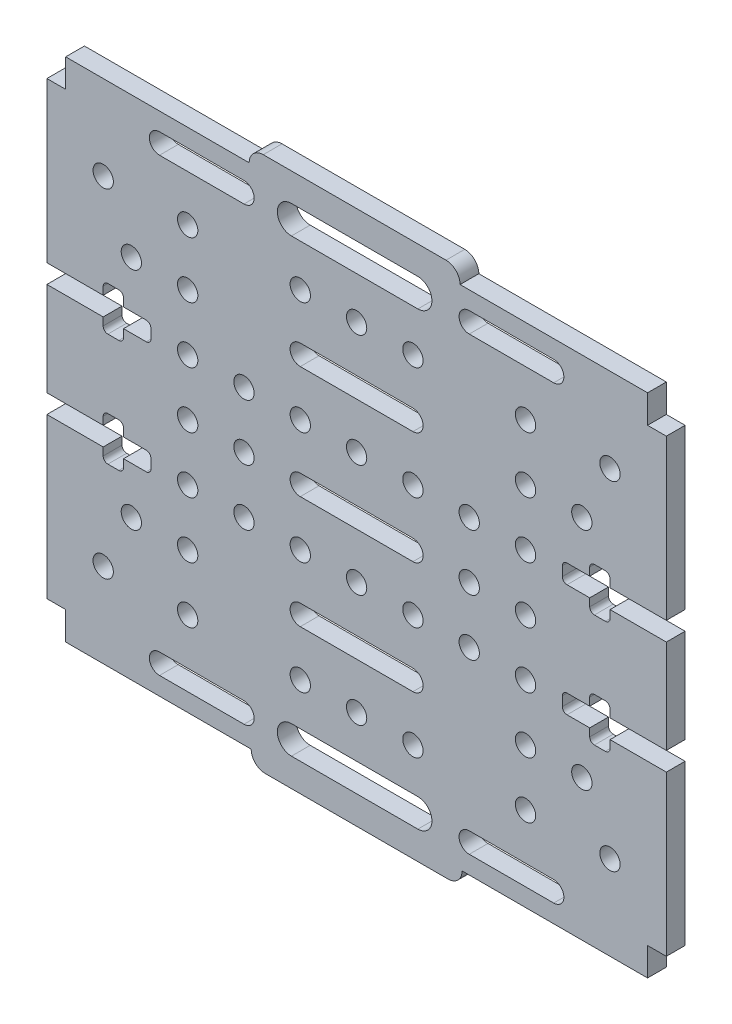
from build123d import *

# Parameters (mm, degrees)
MODEL_R                 = 1.625
SALIENTE_EXTRUIR1_DEPTH = 3


with BuildPart() as part:
    # Model → Saliente-Extruir1 (new body)
    with BuildSketch(Plane.XY):
        with BuildLine():
            Line((-1386.726934946, 396.908179756), (-1386.726934946, 392.408179756))
            Line((-1386.726934946, 392.408179756), (-1383.726934946, 392.408179756))
            Line((-1383.726934946, 392.408179756), (-1383.726934946, 366.908179756))
            Line((-1383.726934946, 366.908179756), (-1392.721934946, 366.908179756))
            Line((-1392.721934946, 366.908179756), (-1392.721934946, 368.158179756))
            ThreePointArc((-1392.721934946, 368.158179756), (-1392.94160486, 368.688509842), (-1393.471934946, 368.908179756))
            Line((-1393.471934946, 368.908179756), (-1395.221934946, 368.908179756))
            ThreePointArc((-1395.221934946, 368.908179756), (-1395.752265032, 368.688509842), (-1395.971934946, 368.158179756))
            Line((-1395.971934946, 368.158179756), (-1395.971934946, 366.908179756))
            Line((-1395.971934946, 366.908179756), (-1399.596934946, 366.908179756))
            ThreePointArc((-1399.596934946, 366.908179756), (-1400.127265032, 366.688509842), (-1400.346934946, 366.158179756))
            Line((-1400.346934946, 366.158179756), (-1400.346934946, 364.658179756))
            ThreePointArc((-1400.346934946, 364.658179756), (-1400.127265032, 364.127849671), (-1399.596934946, 363.908179756))
            Line((-1399.596934946, 363.908179756), (-1395.971934946, 363.908179756))
            Line((-1395.971934946, 363.908179756), (-1395.971934946, 362.658179756))
            ThreePointArc((-1395.971934946, 362.658179756), (-1395.752265032, 362.127849671), (-1395.221934946, 361.908179756))
            Line((-1395.221934946, 361.908179756), (-1393.471934946, 361.908179756))
            ThreePointArc((-1393.471934946, 361.908179756), (-1392.94160486, 362.127849671), (-1392.721934946, 362.658179756))
            Line((-1392.721934946, 362.658179756), (-1392.721934946, 363.908179756))
            Line((-1392.721934946, 363.908179756), (-1383.726934946, 363.908179756))
            Line((-1383.726934946, 363.908179756), (-1383.726934946, 348.908179756))
            Line((-1383.726934946, 348.908179756), (-1392.721934946, 348.908179756))
            Line((-1392.721934946, 348.908179756), (-1392.721934946, 350.158179756))
            ThreePointArc((-1392.721934946, 350.158179756), (-1392.94160486, 350.688509842), (-1393.471934946, 350.908179756))
            Line((-1393.471934946, 350.908179756), (-1395.221934946, 350.908179756))
            ThreePointArc((-1395.221934946, 350.908179756), (-1395.752265032, 350.688509842), (-1395.971934946, 350.158179756))
            Line((-1395.971934946, 350.158179756), (-1395.971934946, 348.908179756))
            Line((-1395.971934946, 348.908179756), (-1399.596934946, 348.908179756))
            ThreePointArc((-1399.596934946, 348.908179756), (-1400.127265032, 348.688509842), (-1400.346934946, 348.158179756))
            Line((-1400.346934946, 348.158179756), (-1400.346934946, 346.658179756))
            ThreePointArc((-1400.346934946, 346.658179756), (-1400.127265032, 346.127849671), (-1399.596934946, 345.908179756))
            Line((-1399.596934946, 345.908179756), (-1395.971934946, 345.908179756))
            Line((-1395.971934946, 345.908179756), (-1395.971934946, 344.658179756))
            ThreePointArc((-1395.971934946, 344.658179756), (-1395.752265032, 344.127849671), (-1395.221934946, 343.908179757))
            Line((-1395.221934946, 343.908179757), (-1393.471934946, 343.908179757))
            ThreePointArc((-1393.471934946, 343.908179757), (-1392.94160486, 344.127849671), (-1392.721934946, 344.658179756))
            Line((-1392.721934946, 344.658179756), (-1392.721934946, 345.908179756))
            Line((-1392.721934946, 345.908179756), (-1383.726934946, 345.908179756))
            Line((-1383.726934946, 345.908179756), (-1383.726934946, 320.408179756))
            Line((-1383.726934946, 320.408179756), (-1386.726934946, 320.408179756))
            Line((-1386.726934946, 320.408179756), (-1386.726934946, 315.908179756))
            Line((-1386.726934946, 315.908179756), (-1416.374030817, 315.908179756))
            ThreePointArc((-1416.374030817, 315.908179756), (-1417.033040559, 314.317189499), (-1418.624030817, 313.658179756))
            Line((-1418.624030817, 313.658179756), (-1447.829839075, 313.658179756))
            ThreePointArc((-1447.829839075, 313.658179756), (-1449.420829333, 314.317189499), (-1450.079839075, 315.908179756))
            Line((-1450.079839075, 315.908179756), (-1479.726934946, 315.908179756))
            Line((-1479.726934946, 315.908179756), (-1479.726934946, 320.408179756))
            Line((-1479.726934946, 320.408179756), (-1482.726934946, 320.408179756))
            Line((-1482.726934946, 320.408179756), (-1482.726934946, 345.908179756))
            Line((-1482.726934946, 345.908179756), (-1473.731934946, 345.908179756))
            Line((-1473.731934946, 345.908179756), (-1473.731934946, 344.658179756))
            ThreePointArc((-1473.731934946, 344.658179756), (-1473.512265032, 344.127849671), (-1472.981934946, 343.908179757))
            Line((-1472.981934946, 343.908179757), (-1471.231934946, 343.908179757))
            ThreePointArc((-1471.231934946, 343.908179757), (-1470.70160486, 344.127849671), (-1470.481934946, 344.658179756))
            Line((-1470.481934946, 344.658179756), (-1470.481934946, 345.908179756))
            Line((-1470.481934946, 345.908179756), (-1466.856934946, 345.908179756))
            ThreePointArc((-1466.856934946, 345.908179756), (-1466.32660486, 346.127849671), (-1466.106934946, 346.658179756))
            Line((-1466.106934946, 346.658179756), (-1466.106934946, 348.158179756))
            ThreePointArc((-1466.106934946, 348.158179756), (-1466.32660486, 348.688509842), (-1466.856934946, 348.908179756))
            Line((-1466.856934946, 348.908179756), (-1470.481934946, 348.908179756))
            Line((-1470.481934946, 348.908179756), (-1470.481934946, 350.158179756))
            ThreePointArc((-1470.481934946, 350.158179756), (-1470.70160486, 350.688509842), (-1471.231934946, 350.908179756))
            Line((-1471.231934946, 350.908179756), (-1472.981934946, 350.908179756))
            ThreePointArc((-1472.981934946, 350.908179756), (-1473.512265032, 350.688509842), (-1473.731934946, 350.158179756))
            Line((-1473.731934946, 350.158179756), (-1473.731934946, 348.908179756))
            Line((-1473.731934946, 348.908179756), (-1482.726934946, 348.908179756))
            Line((-1482.726934946, 348.908179756), (-1482.726934946, 363.908179756))
            Line((-1482.726934946, 363.908179756), (-1473.731934946, 363.908179756))
            Line((-1473.731934946, 363.908179756), (-1473.731934946, 362.658179756))
            ThreePointArc((-1473.731934946, 362.658179756), (-1473.512265032, 362.127849671), (-1472.981934946, 361.908179756))
            Line((-1472.981934946, 361.908179756), (-1471.231934946, 361.908179756))
            ThreePointArc((-1471.231934946, 361.908179756), (-1470.70160486, 362.127849671), (-1470.481934946, 362.658179756))
            Line((-1470.481934946, 362.658179756), (-1470.481934946, 363.908179756))
            Line((-1470.481934946, 363.908179756), (-1466.856934946, 363.908179756))
            ThreePointArc((-1466.856934946, 363.908179756), (-1466.32660486, 364.127849671), (-1466.106934946, 364.658179756))
            Line((-1466.106934946, 364.658179756), (-1466.106934946, 366.158179756))
            ThreePointArc((-1466.106934946, 366.158179756), (-1466.32660486, 366.688509842), (-1466.856934946, 366.908179756))
            Line((-1466.856934946, 366.908179756), (-1470.481934946, 366.908179756))
            Line((-1470.481934946, 366.908179756), (-1470.481934946, 368.158179756))
            ThreePointArc((-1470.481934946, 368.158179756), (-1470.70160486, 368.688509842), (-1471.231934946, 368.908179756))
            Line((-1471.231934946, 368.908179756), (-1472.981934946, 368.908179756))
            ThreePointArc((-1472.981934946, 368.908179756), (-1473.512265032, 368.688509842), (-1473.731934946, 368.158179756))
            Line((-1473.731934946, 368.158179756), (-1473.731934946, 366.908179756))
            Line((-1473.731934946, 366.908179756), (-1482.726934946, 366.908179756))
            Line((-1482.726934946, 366.908179756), (-1482.726934946, 392.408179756))
            Line((-1482.726934946, 392.408179756), (-1479.726934946, 392.408179756))
            Line((-1479.726934946, 392.408179756), (-1479.726934946, 396.908179756))
            Line((-1479.726934946, 396.908179756), (-1450.397354792, 396.908179756))
            ThreePointArc((-1450.397354792, 396.908179756), (-1449.73834505, 398.499170014), (-1448.147354793, 399.158179756))
            Line((-1448.147354793, 399.158179756), (-1418.941546534, 399.158179756))
            ThreePointArc((-1418.941546534, 399.158179756), (-1417.350556277, 398.499170014), (-1416.691546534, 396.908179756))
            Line((-1416.691546534, 396.908179756), (-1386.726934946, 396.908179756))
        make_face()
        with Locations((-1433.229894918, 365.413124117)):
            Circle(MODEL_R, mode=Mode.SUBTRACT)
        with Locations((-1433.229894918, 347.413124117)):
            Circle(MODEL_R, mode=Mode.SUBTRACT)
        with Locations((-1433.229894918, 329.413124117)):
            Circle(MODEL_R, mode=Mode.SUBTRACT)
        with Locations((-1433.229894918, 383.413124117)):
            Circle(MODEL_R, mode=Mode.SUBTRACT)
        with Locations((-1460.229894918, 374.413124117)):
            Circle(MODEL_R, mode=Mode.SUBTRACT)
        with Locations((-1460.229894918, 365.413124117)):
            Circle(MODEL_R, mode=Mode.SUBTRACT)
        with Locations((-1460.229894918, 356.413124117)):
            Circle(MODEL_R, mode=Mode.SUBTRACT)
        with Locations((-1460.229894918, 347.413124117)):
            Circle(MODEL_R, mode=Mode.SUBTRACT)
        with Locations((-1460.229894918, 338.413124117)):
            Circle(MODEL_R, mode=Mode.SUBTRACT)
        with Locations((-1460.229894918, 329.413124117)):
            Circle(MODEL_R, mode=Mode.SUBTRACT)
        with Locations((-1460.229894918, 383.413124117)):
            Circle(MODEL_R, mode=Mode.SUBTRACT)
        with Locations((-1406.229894918, 374.413124117)):
            Circle(MODEL_R, mode=Mode.SUBTRACT)
        with Locations((-1406.229894918, 365.413124117)):
            Circle(MODEL_R, mode=Mode.SUBTRACT)
        with Locations((-1406.229894918, 356.413124117)):
            Circle(MODEL_R, mode=Mode.SUBTRACT)
        with Locations((-1406.229894918, 347.413124117)):
            Circle(MODEL_R, mode=Mode.SUBTRACT)
        with Locations((-1406.229894918, 338.413124117)):
            Circle(MODEL_R, mode=Mode.SUBTRACT)
        with Locations((-1406.229894918, 329.413124117)):
            Circle(MODEL_R, mode=Mode.SUBTRACT)
        with Locations((-1406.229894918, 383.413124117)):
            Circle(MODEL_R, mode=Mode.SUBTRACT)
        with Locations((-1424.229894918, 383.413124117)):
            Circle(MODEL_R, mode=Mode.SUBTRACT)
        with Locations((-1442.229894918, 383.413124117)):
            Circle(MODEL_R, mode=Mode.SUBTRACT)
        with Locations((-1424.229894918, 365.413124117)):
            Circle(MODEL_R, mode=Mode.SUBTRACT)
        with Locations((-1442.229894918, 365.413124117)):
            Circle(MODEL_R, mode=Mode.SUBTRACT)
        with Locations((-1424.229894918, 347.413124117)):
            Circle(MODEL_R, mode=Mode.SUBTRACT)
        with Locations((-1442.229894918, 347.413124117)):
            Circle(MODEL_R, mode=Mode.SUBTRACT)
        with Locations((-1424.229894918, 329.413124117)):
            Circle(MODEL_R, mode=Mode.SUBTRACT)
        with Locations((-1442.229894918, 329.413124117)):
            Circle(MODEL_R, mode=Mode.SUBTRACT)
        with Locations((-1415.229894918, 365.413124117)):
            Circle(MODEL_R, mode=Mode.SUBTRACT)
        with Locations((-1415.229894918, 356.413124117)):
            Circle(MODEL_R, mode=Mode.SUBTRACT)
        with Locations((-1415.229894918, 347.413124117)):
            Circle(MODEL_R, mode=Mode.SUBTRACT)
        with Locations((-1451.229894918, 365.413124117)):
            Circle(MODEL_R, mode=Mode.SUBTRACT)
        with Locations((-1451.229894918, 356.413124117)):
            Circle(MODEL_R, mode=Mode.SUBTRACT)
        with Locations((-1451.229894918, 347.413124117)):
            Circle(MODEL_R, mode=Mode.SUBTRACT)
        with Locations((-1473.729560416, 383.413124117)):
            Circle(MODEL_R, mode=Mode.SUBTRACT)
        with Locations((-1392.729894918, 383.413124117)):
            Circle(MODEL_R, mode=Mode.SUBTRACT)
        with Locations((-1473.729560416, 329.413124117)):
            Circle(MODEL_R, mode=Mode.SUBTRACT)
        with Locations((-1392.729894918, 329.413124117)):
            Circle(MODEL_R, mode=Mode.SUBTRACT)
        with Locations((-1469.229894918, 374.413124117)):
            Circle(MODEL_R, mode=Mode.SUBTRACT)
        with Locations((-1469.229894918, 338.413124117)):
            Circle(MODEL_R, mode=Mode.SUBTRACT)
        with Locations((-1397.229894918, 374.413124117)):
            Circle(MODEL_R, mode=Mode.SUBTRACT)
        with Locations((-1397.229894918, 338.413124117)):
            Circle(MODEL_R, mode=Mode.SUBTRACT)
        with BuildLine():
            Line((-1443.647354792, 394.658179756), (-1423.441546534, 394.658179756))
            ThreePointArc((-1423.441546534, 394.658179756), (-1421.191546534, 392.408179756), (-1423.441546534, 390.158179756))
            Line((-1423.441546534, 390.158179756), (-1443.647354792, 390.158179756))
            ThreePointArc((-1443.647354792, 390.158179756), (-1445.897354792, 392.408179756), (-1443.647354792, 394.658179756))
        make_face(mode=Mode.SUBTRACT)
        with BuildLine():
            Line((-1443.644450663, 322.658179756), (-1423.438642405, 322.658179756))
            ThreePointArc((-1423.438642405, 322.658179756), (-1421.188642405, 320.408179756), (-1423.438642405, 318.158179756))
            Line((-1423.438642405, 318.158179756), (-1443.644450663, 318.158179756))
            ThreePointArc((-1443.644450663, 318.158179756), (-1445.894450663, 320.408179756), (-1443.644450663, 322.658179756))
        make_face(mode=Mode.SUBTRACT)
        with BuildLine():
            Line((-1442.229894918, 376.038124117), (-1424.229894918, 376.038124117))
            ThreePointArc((-1424.229894918, 376.038124117), (-1422.604894918, 374.413124117), (-1424.229894918, 372.788124117))
            Line((-1424.229894918, 372.788124117), (-1442.229894918, 372.788124117))
            ThreePointArc((-1442.229894918, 372.788124117), (-1443.854894918, 374.413124117), (-1442.229894918, 376.038124117))
        make_face(mode=Mode.SUBTRACT)
        with BuildLine():
            Line((-1442.229894918, 358.038124117), (-1424.229894918, 358.038124117))
            ThreePointArc((-1424.229894918, 358.038124117), (-1422.604894918, 356.413124117), (-1424.229894918, 354.788124117))
            Line((-1424.229894918, 354.788124117), (-1442.229894918, 354.788124117))
            ThreePointArc((-1442.229894918, 354.788124117), (-1443.854894918, 356.413124117), (-1442.229894918, 358.038124117))
        make_face(mode=Mode.SUBTRACT)
        with BuildLine():
            Line((-1442.229894918, 340.038124117), (-1424.229894918, 340.038124117))
            ThreePointArc((-1424.229894918, 340.038124117), (-1422.604894918, 338.413124117), (-1424.229894918, 336.788124117))
            Line((-1424.229894918, 336.788124117), (-1442.229894918, 336.788124117))
            ThreePointArc((-1442.229894918, 336.788124117), (-1443.854894918, 338.413124117), (-1442.229894918, 340.038124117))
        make_face(mode=Mode.SUBTRACT)
        with BuildLine():
            Line((-1464.727354792, 322.033179756), (-1451.227354792, 322.033179756))
            ThreePointArc((-1451.227354792, 322.033179756), (-1449.602354792, 320.408179756), (-1451.227354792, 318.783179756))
            Line((-1451.227354792, 318.783179756), (-1464.727354792, 318.783179756))
            ThreePointArc((-1464.727354792, 318.783179756), (-1466.352354792, 320.408179756), (-1464.727354792, 322.033179756))
        make_face(mode=Mode.SUBTRACT)
        with BuildLine():
            Line((-1415.227354792, 322.033179756), (-1401.727354792, 322.033179756))
            ThreePointArc((-1401.727354792, 322.033179756), (-1400.102354792, 320.408179756), (-1401.727354792, 318.783179756))
            Line((-1401.727354792, 318.783179756), (-1415.227354792, 318.783179756))
            ThreePointArc((-1415.227354792, 318.783179756), (-1416.852354792, 320.408179756), (-1415.227354792, 322.033179756))
        make_face(mode=Mode.SUBTRACT)
        with BuildLine():
            Line((-1415.229894918, 394.038124117), (-1401.729894918, 394.038124117))
            ThreePointArc((-1401.729894918, 394.038124117), (-1400.104894918, 392.413124117), (-1401.729894918, 390.788124117))
            Line((-1401.729894918, 390.788124117), (-1415.229894918, 390.788124117))
            ThreePointArc((-1415.229894918, 390.788124117), (-1416.854894918, 392.413124117), (-1415.229894918, 394.038124117))
        make_face(mode=Mode.SUBTRACT)
        with BuildLine():
            Line((-1464.729560416, 394.038124117), (-1451.229894918, 394.038124117))
            ThreePointArc((-1451.229894918, 394.038124117), (-1449.604894918, 392.413124117), (-1451.229894918, 390.788124117))
            Line((-1451.229894918, 390.788124117), (-1464.729560416, 390.788124117))
            ThreePointArc((-1464.729560416, 390.788124117), (-1466.354560416, 392.413124117), (-1464.729560416, 394.038124117))
        make_face(mode=Mode.SUBTRACT)
    extrude(amount=SALIENTE_EXTRUIR1_DEPTH)


solid = part.part
